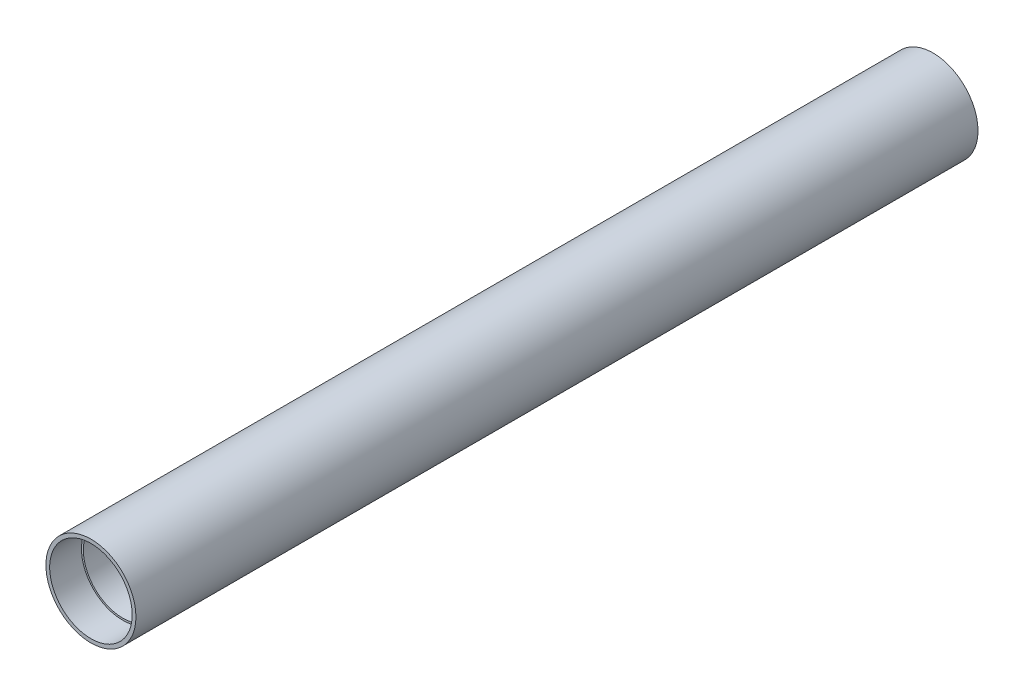
from build123d import *

# Parameters (mm, degrees)
SKETCH1_R           = 19.05
SKETCH1_R_2         = 16.6751
BOSS_EXTRUDE1_DEPTH = 356.362
SKETCH2_R           = 17.4625
CUT_EXTRUDE1_DEPTH  = 13.462
CUT_EXTRUDE2_START  = -13.462
SKETCH3_R           = 17.4625
CUT_EXTRUDE2_DEPTH  = 13.462


with BuildPart() as part:
    # Sketch1 → Boss-Extrude1 (new body)
    with BuildSketch(Plane.XY):
        Circle(SKETCH1_R)
        Circle(SKETCH1_R_2, mode=Mode.SUBTRACT)
    extrude(amount=BOSS_EXTRUDE1_DEPTH)

    # Sketch2 → Cut-Extrude1 (cut)
    with BuildSketch(Plane.XY.offset(356.362)):
        Circle(SKETCH2_R)
    extrude(amount=-CUT_EXTRUDE1_DEPTH, mode=Mode.SUBTRACT)

    # Sketch3 → Cut-Extrude2 (cut)
    with BuildSketch(Plane(origin=(0, 0, 0), x_dir=(-1, 0, 0), z_dir=(0, 0, -1)).offset(CUT_EXTRUDE2_START)):
        with Locations(Location((0, 0, 0), (0, 0, 180))):
            Circle(SKETCH3_R)
    extrude(amount=CUT_EXTRUDE2_DEPTH, mode=Mode.SUBTRACT)


solid = part.part
